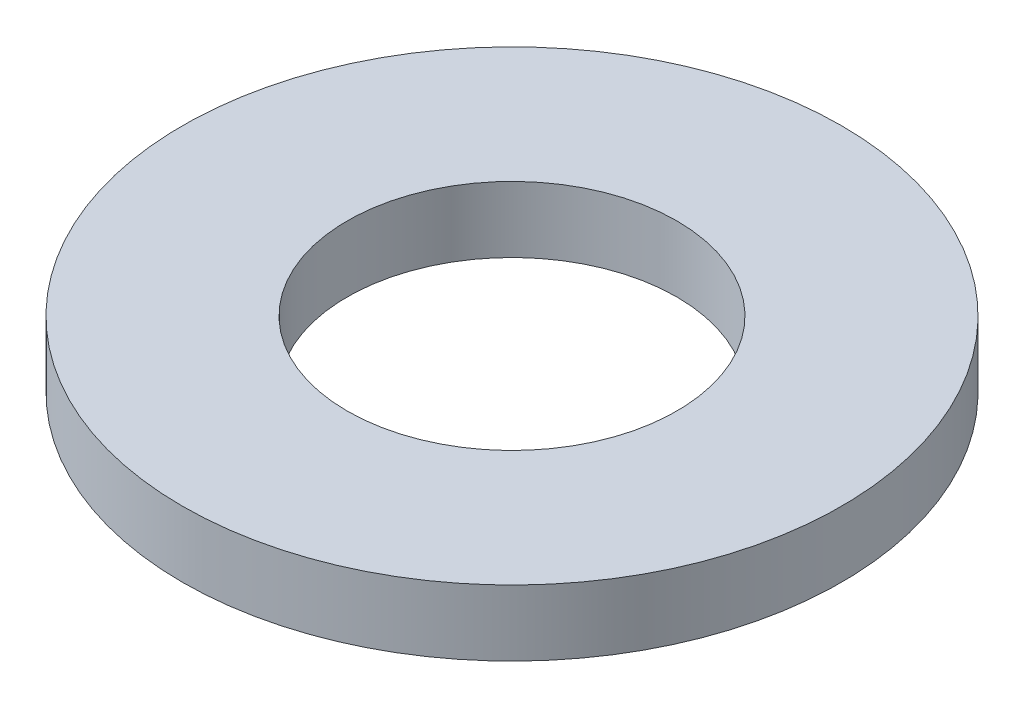
from build123d import *

# Parameters (mm, degrees)
SKETCH_1_R      = 250
SKETCH_1_R_2    = 125
EXTRUDE_1_DEPTH = 50


with BuildPart() as part:
    # 草图1 → 凸台-拉伸1 (new body)
    with BuildSketch(Plane(origin=(0, 0, 0), x_dir=(1, 0, 0), z_dir=(0, 1, 0))):
        with Locations(Location((0, 0, 0), (0, 0, 270))):
            Circle(SKETCH_1_R)
        with Locations(Location((0, 0, 0), (0, 0, 270))):
            Circle(SKETCH_1_R_2, mode=Mode.SUBTRACT)
    extrude(amount=EXTRUDE_1_DEPTH)


solid = part.part
